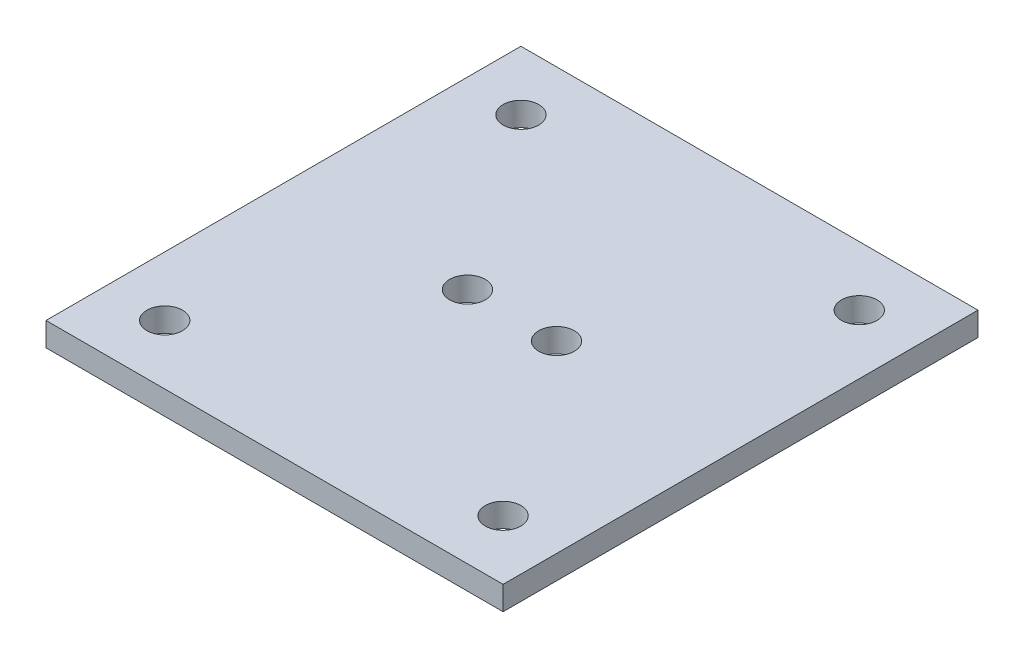
from build123d import *

# Parameters (mm, degrees)
SKETCH1_W           = 77
SKETCH1_H           = 80
SKETCH1_R           = 3
BOSS_EXTRUDE1_DEPTH = 2


with BuildPart() as part:
    # Sketch1 → Boss-Extrude1 (new, symmetric)
    with BuildSketch(Plane(origin=(0, 0, 0), x_dir=(1, 0, 0), z_dir=(0, 1, 0))):
        Rectangle(SKETCH1_W, SKETCH1_H)
        with Locations(Location((-7.5, 0, 0), (0, 0, 270))):
            Circle(SKETCH1_R, mode=Mode.SUBTRACT)
        with Locations(Location((7.5, 0, 0), (0, 0, 270))):
            Circle(SKETCH1_R, mode=Mode.SUBTRACT)
        with Locations(Location((-28.5, 30, 0), (0, 0, 270))):
            Circle(SKETCH1_R, mode=Mode.SUBTRACT)
        with Locations(Location((28.5, 30, 0), (0, 0, 270))):
            Circle(SKETCH1_R, mode=Mode.SUBTRACT)
        with Locations(Location((28.5, -30, 0), (0, 0, 90))):
            Circle(SKETCH1_R, mode=Mode.SUBTRACT)
        with Locations(Location((-28.5, -30, 0), (0, 0, 90))):
            Circle(SKETCH1_R, mode=Mode.SUBTRACT)
    extrude(amount=BOSS_EXTRUDE1_DEPTH, both=True)


solid = part.part
